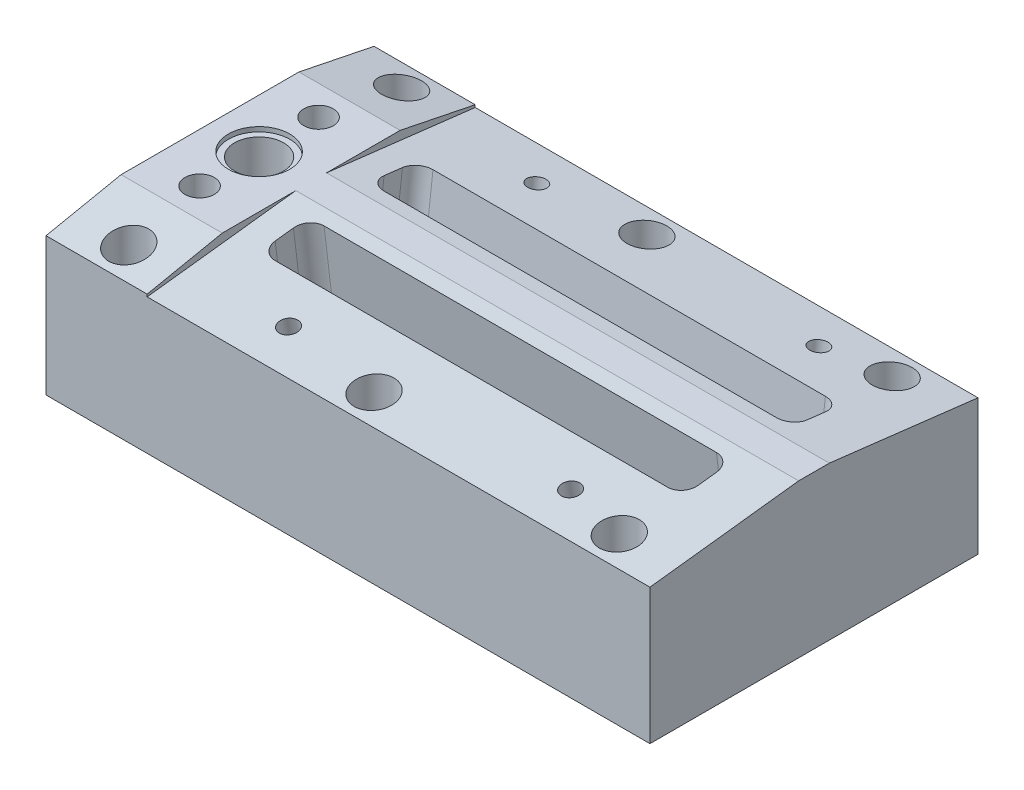
from build123d import *

# Parameters (mm, degrees)
SKETCH1_W           = 197
SKETCH1_H           = 107
BOSS_EXTRUDE1_DEPTH = 50
SKETCH4_W           = 182
SKETCH4_H           = 45
CUT_EXTRUDE2_DEPTH  = 25
CUT_EXTRUDE3_DEPTH  = 164
CUT_EXTRUDE12_DEPTH = 164
CUT_EXTRUDE5_DEPTH  = 230.691096911
SKETCH9_R           = 8
CUT_EXTRUDE6_DEPTH  = 171
SKETCH10_R          = 10
CUT_EXTRUDE7_DEPTH  = 1.5
SKETCH11_R          = 4.8
CUT_EXTRUDE8_DEPTH  = 12.5
SKETCH12_R          = 6.5
CUT_EXTRUDE9_DEPTH  = 230.691096911
SKETCH13_R          = 3
CUT_EXTRUDE10_DEPTH = 26.5
SKETCH14_R          = 3
CUT_EXTRUDE11_DEPTH = 26.5
CUT_EXTRUDE14_DEPTH = 35
CUT_EXTRUDE15_DEPTH = 130


with BuildPart() as part:
    # Sketch1 → Boss-Extrude1 (new body)
    with BuildSketch(Plane(origin=(0, 0, 0), x_dir=(1, 0, 0), z_dir=(0, 1, 0))):
        with Locations((98.5, 53.5)):
            Rectangle(SKETCH1_W, SKETCH1_H)
    extrude(amount=BOSS_EXTRUDE1_DEPTH)

    # Sketch4 → Cut-Extrude2 (cut)
    with BuildSketch(Plane(origin=(0, 0, 0), x_dir=(1, 0, 0), z_dir=(0, 1, 0))):
        with Locations((98.5, 53.5)):
            Rectangle(SKETCH4_W, SKETCH4_H)
    extrude(amount=CUT_EXTRUDE2_DEPTH, mode=Mode.SUBTRACT)

    # Sketch5 → Cut-Extrude3 (cut)
    with BuildSketch(Plane(origin=(197, 0, 0), x_dir=(0, 0, -1), z_dir=(1, 0, 0))):
        Polygon((58.5, 50), (107, 44.216725137), (107, 50), align=None)
    extrude(amount=-CUT_EXTRUDE3_DEPTH, mode=Mode.SUBTRACT)

    # Sketch18 → Cut-Extrude12 (cut)
    with BuildSketch(Plane(origin=(197, 0, 0), x_dir=(0, 0, -1), z_dir=(1, 0, 0))):
        Polygon((0, 44.216725137), (0, 50), (48.5, 50), align=None)
    extrude(amount=-CUT_EXTRUDE12_DEPTH, mode=Mode.SUBTRACT)

    # Sketch7 → Cut-Extrude5 (cut, through all)
    with BuildSketch(Plane(origin=(0, 0, 0), x_dir=(0, 0, -1), z_dir=(1, 0, 0))):
        Polygon((107, 50), (107, 45), (82.505102572, 50), align=None)
        Polygon((0, 45), (0, 50), (24.494897428, 50), align=None)
    extrude(amount=CUT_EXTRUDE5_DEPTH, mode=Mode.SUBTRACT)

    # Sketch9 → Cut-Extrude6 (cut)
    with BuildSketch(Plane(origin=(0, 50, 0), x_dir=(1, 0, 0), z_dir=(0, 1, 0))):
        with Locations(Location((16, 53.5, 0), (0, 0, 270))):
            Circle(SKETCH9_R)
    extrude(amount=-CUT_EXTRUDE6_DEPTH, mode=Mode.SUBTRACT)

    # Sketch10 → Cut-Extrude7 (cut)
    with BuildSketch(Plane(origin=(0, 50, 0), x_dir=(1, 0, 0), z_dir=(0, 1, 0))):
        with Locations(Location((16, 53.5, 0), (0, 0, 270))):
            Circle(SKETCH10_R)
    extrude(amount=-CUT_EXTRUDE7_DEPTH, mode=Mode.SUBTRACT)

    # Sketch11 → Cut-Extrude8 (cut)
    with BuildSketch(Plane(origin=(0, 50, 0), x_dir=(1, 0, 0), z_dir=(0, 1, 0))):
        with Locations(Location((16, 72.905102572, 0), (0, 0, 270))):
            Circle(SKETCH11_R)
        with Locations(Location((16, 34.094897428, 0), (0, 0, 270))):
            Circle(SKETCH11_R)
    extrude(amount=-CUT_EXTRUDE8_DEPTH, mode=Mode.SUBTRACT)

    # Sketch12 → Cut-Extrude9 (cut, through all)
    with BuildSketch(Plane(origin=(0, 50, 0), x_dir=(1, 0, 0), z_dir=(0, 1, 0))):
        with Locations(Location((18, 98, 0), (0, 0, 270))):
            Circle(SKETCH12_R)
        with Locations(Location((98, 9, 0), (0, 0, 270))):
            Circle(SKETCH12_R)
        with Locations(Location((178, 9, 0), (0, 0, 270))):
            Circle(SKETCH12_R)
        with Locations(Location((18, 9, 0), (0, 0, 270))):
            Circle(SKETCH12_R)
        with Locations(Location((98, 98, 0), (0, 0, 270))):
            Circle(SKETCH12_R)
        with Locations(Location((178, 98, 0), (0, 0, 270))):
            Circle(SKETCH12_R)
    extrude(amount=-CUT_EXTRUDE9_DEPTH, mode=Mode.SUBTRACT)

    # Sketch13 → Cut-Extrude10 (cut)
    with BuildSketch(Plane(origin=(0, 56.176931823, -6.698693561), x_dir=(1, 0, 0), z_dir=(0, 0.9929655081065378, -0.11840396830649387))):
        with Locations(Location((66, 88.011873646, 0), (0, 0, 270))):
            Circle(SKETCH13_R)
        with Locations(Location((158, 88.011873646, 0), (0, 0, 270))):
            Circle(SKETCH13_R)
    extrude(amount=-CUT_EXTRUDE10_DEPTH, mode=Mode.SUBTRACT)

    # Sketch14 → Cut-Extrude11 (cut)
    with BuildSketch(Plane(origin=(0, 43.2, 8.818163074), x_dir=(1, 0, 0), z_dir=(0, 0.9797958971132713, 0.2000000000000002))):
        with Locations(Location((66, 22, 0), (0, 0, 270))):
            Circle(SKETCH14_R)
        with Locations(Location((158, 22, 0), (0, 0, 270))):
            Circle(SKETCH14_R)
    extrude(amount=-CUT_EXTRUDE11_DEPTH, mode=Mode.SUBTRACT)

    # Sketch23 → Cut-Extrude14 (cut)
    with BuildSketch(Plane(origin=(0, 43.596828772, 5.198607092), x_dir=(1, 0, 0), z_dir=(0, 0.9929655081065377, 0.11840396830649416))):
        with BuildLine():
            Line((47, 49.235435722), (175, 49.235435722))
            ThreePointArc((175, 49.235435722), (178.535533906, 47.770969628), (180, 44.235435722))
            Line((180, 44.235435722), (180, 38.235435722))
            ThreePointArc((180, 38.235435722), (178.535533906, 34.699901816), (175, 33.235435722))
            Line((175, 33.235435722), (47, 33.235435722))
            ThreePointArc((47, 33.235435722), (43.464466094, 34.699901816), (42, 38.235435722))
            Line((42, 38.235435722), (42, 44.235435722))
            ThreePointArc((42, 44.235435722), (43.464466094, 47.770969628), (47, 49.235435722))
        make_face()
    extrude(amount=-CUT_EXTRUDE14_DEPTH, mode=Mode.SUBTRACT)

    # Sketch6 → Cut-Extrude15 (cut)
    with BuildSketch(Plane(origin=(0, 56.176931823, -6.698693561), x_dir=(1, 0, 0), z_dir=(0, 0.9929655081065378, -0.11840396830649387))):
        with BuildLine():
            Line((47, 73.04559264), (175, 73.04559264))
            ThreePointArc((175, 73.04559264), (178.535533906, 71.581126546), (180, 68.04559264))
            Line((180, 68.04559264), (180, 62.011873646))
            ThreePointArc((180, 62.011873646), (178.535533906, 58.47633974), (175, 57.011873646))
            Line((175, 57.011873646), (47, 57.011873646))
            ThreePointArc((47, 57.011873646), (43.464466094, 58.47633974), (42, 62.011873646))
            Line((42, 62.011873646), (42, 68.04559264))
            ThreePointArc((42, 68.04559264), (43.464466094, 71.581126546), (47, 73.04559264))
        make_face()
    extrude(amount=-CUT_EXTRUDE15_DEPTH, mode=Mode.SUBTRACT)


solid = part.part
